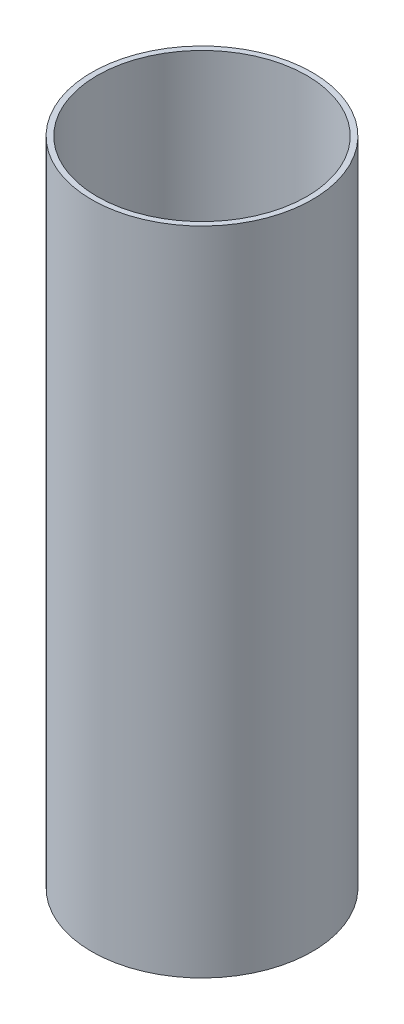
from build123d import *

# Parameters (mm, degrees)
SKETCH1_R           = 25.4
SKETCH1_R_2         = 24.15
BOSS_EXTRUDE1_DEPTH = 150


with BuildPart() as part:
    # Sketch1 → Boss-Extrude1 (new body)
    with BuildSketch(Plane(origin=(0, 0, 0), x_dir=(1, 0, 0), z_dir=(0, 1, 0))):
        with Locations(Location((0, 0, 0), (0, 0, 270))):
            Circle(SKETCH1_R)
        with Locations(Location((0, 0, 0), (0, 0, 270))):
            Circle(SKETCH1_R_2, mode=Mode.SUBTRACT)
    extrude(amount=BOSS_EXTRUDE1_DEPTH)


solid = part.part
